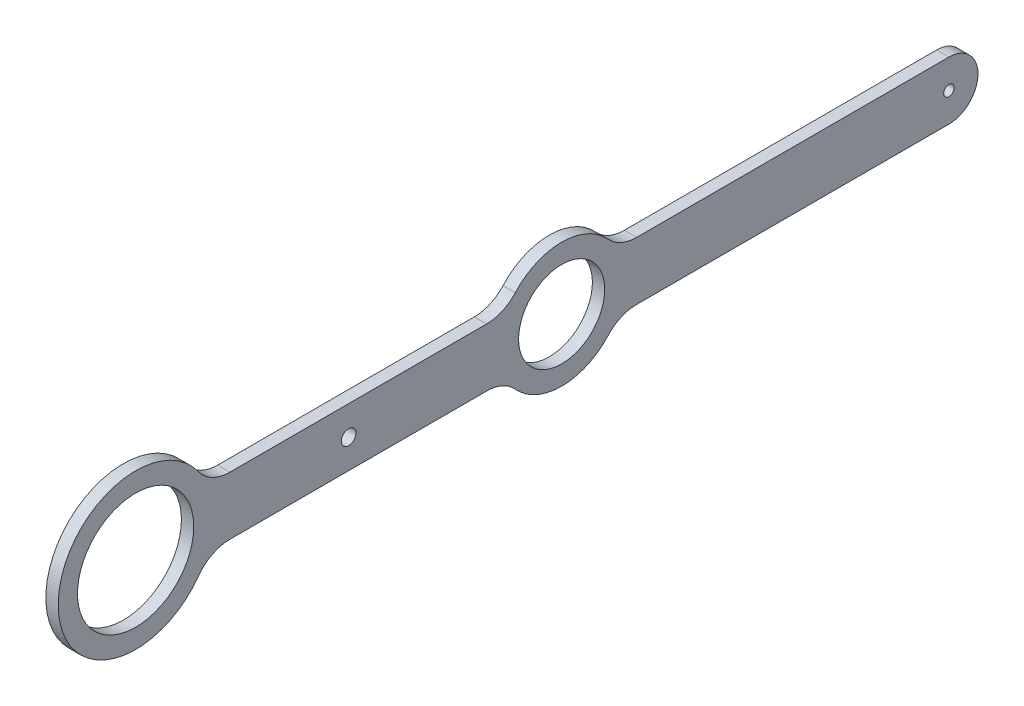
from build123d import *

# Parameters (mm, degrees)
SKETCH1_R             = 15
SKETCH1_R_2           = 11.1125
BOSS_EXTRUDE1_DEPTH   = 3.175
F_6_CLEARANCE_HOLE1_D = 3.7973
F_6_32_TAPPED_HOLE1_D = 2.7051
FILLET1_R             = 10


with BuildPart() as part:
    # Sketch1 → Boss-Extrude1 (new body)
    with BuildSketch(Plane(origin=(0, 0, 0), x_dir=(0, 0, -1), z_dir=(1, 0, 0))):
        with BuildLine():
            ThreePointArc((-91.459503782, 7.5), (-130, 0), (-91.459503782, -7.5))
            Line((-91.459503782, -7.5), (-14.260527909, -7.5))
            ThreePointArc((-14.260527909, -7.5), (0, -16.1125), (14.260527909, -7.5))
            Line((14.260527909, -7.5), (100, -7.5))
            ThreePointArc((100, -7.5), (107.5, 0), (100, 7.5))
            Line((100, 7.5), (14.260527909, 7.5))
            ThreePointArc((14.260527909, 7.5), (0, 16.1125), (-14.260527909, 7.5))
            Line((-14.260527909, 7.5), (-91.459503782, 7.5))
        make_face()
        with Locations((-110, 0)):
            Circle(SKETCH1_R, mode=Mode.SUBTRACT)
        Circle(SKETCH1_R_2, mode=Mode.SUBTRACT)
    extrude(amount=BOSS_EXTRUDE1_DEPTH)

    # #6 Clearance Hole1 (through all)
    with Locations(Plane(origin=(3.175, 0, 0), x_dir=(0, 0, -1), z_dir=(1, 0, 0))):
        with Locations((-55, 0)):
            Hole(F_6_CLEARANCE_HOLE1_D / 2)

    # #6-32 Tapped Hole1 (through all)
    with Locations(Plane(origin=(3.175, 0, 0), x_dir=(0, 0, -1), z_dir=(1, 0, 0))):
        with Locations((100, 0)):
            Hole(F_6_32_TAPPED_HOLE1_D / 2)

    # Fillet1
    fillet1_edges = [part.edges().sort_by_distance(p)[0] for p in [
        (1.5875, 7.5, 91.459503782),
        (1.5875, 7.5, 14.260527909),
        (1.5875, 7.5, -14.260527909),
        (1.5875, -7.5, -14.260527909),
        (1.5875, -7.5, 14.260527909),
        (1.5875, -7.5, 91.459503782),
    ]]
    fillet(fillet1_edges, radius=FILLET1_R)


solid = part.part
